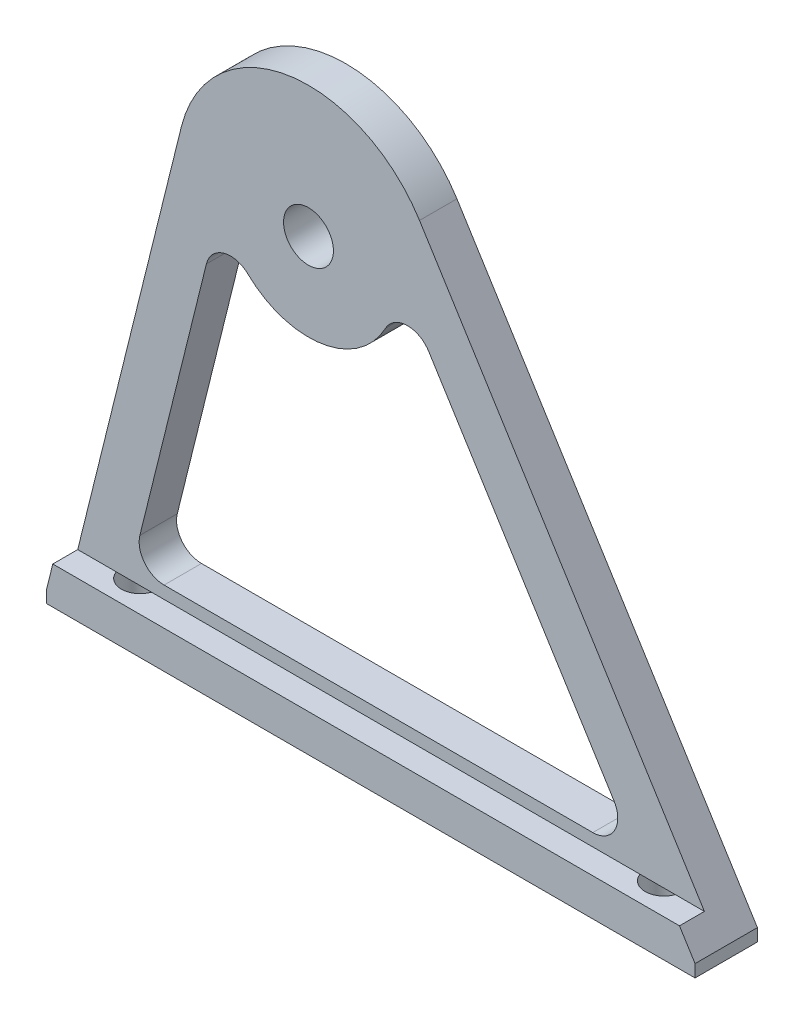
from build123d import *

# Parameters (mm, degrees)
SKETCH_1_R          = 2
EXTRUDE_1_DEPTH     = 5
SKETCH_2_W          = 105.590665855
SKETCH_2_H          = 53.734325109
CUT_EXTRUDE_1_DEPTH = 2
SKETCH_4_R          = 1.5
CUT_EXTRUDE_2_DEPTH = 3


with BuildPart() as part:
    # 草图1 → 凸台-拉伸1 (new body)
    with BuildSketch(Plane.XY):
        with BuildLine():
            Line((-10.191413347, 2.526874351), (-19, -33))
            Line((-19, -33), (-19, -34))
            Line((-19, -34), (33, -34))
            Line((33, -34), (33, -33))
            Line((33, -33), (8.904718959, 5.563809869))
            ThreePointArc((8.904718959, 5.563809869), (-1.649133089, 10.369684665), (-10.191413347, 2.526874351))
        make_face()
        Circle(SKETCH_1_R, mode=Mode.SUBTRACT)
        with BuildLine():
            Line((-8.452697078, -7.081843943), (-13.519839571, -27.5186906))
            ThreePointArc((-13.519839571, -27.5186906), (-13.153835237, -29.232351654), (-11.578617982, -30))
            Line((-11.578617982, -30), (22.801020138, -30))
            ThreePointArc((22.801020138, -30), (24.55024091, -28.969652872), (24.497157083, -26.940226692))
            Line((24.497157083, -26.940226692), (9.642502803, -3.165776319))
            ThreePointArc((9.642502803, -3.165776319), (7.876643723, -2.22676529), (6.180506778, -3.286538599))
            ThreePointArc((6.180506778, -3.286538599), (1.099422059, -6.91312311), (-4.856029369, -5.041723789))
            ThreePointArc((-4.856029369, -5.041723789), (-6.797250959, -4.560414389), (-8.184687922, -6.0009069))
            Line((-8.184687922, -6.0009069), (-8.452697078, -7.081843943))
        make_face(mode=Mode.SUBTRACT)
    extrude(amount=EXTRUDE_1_DEPTH)

    # 草图2 → 切除-拉伸1 (cut)
    with BuildSketch(Plane.XY.offset(5)):
        with Locations((1.500851151, -4.132837446)):
            Rectangle(SKETCH_2_W, SKETCH_2_H)
    extrude(amount=-CUT_EXTRUDE_1_DEPTH, mode=Mode.SUBTRACT)

    # 草图4 → 切除-拉伸2 (cut)
    with BuildSketch(Plane(origin=(0, -34, 0), x_dir=(-1, 0, 0), z_dir=(0, -1, 0))):
        with Locations(Location((14, -2.5, 0), (0, 0, 90))):
            Circle(SKETCH_4_R)
        with Locations(Location((-28, -2.5, 0), (0, 0, 90))):
            Circle(SKETCH_4_R)
    extrude(amount=-CUT_EXTRUDE_2_DEPTH, mode=Mode.SUBTRACT)


solid = part.part
